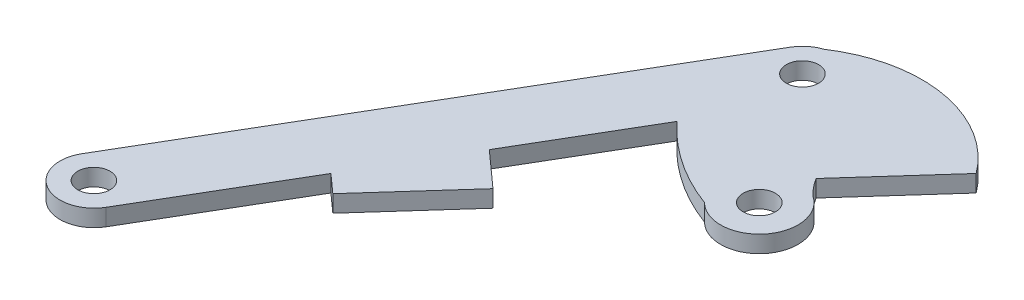
from build123d import *

# Parameters (mm, degrees)
SALIENTE_EXTRUIR1_DEPTH = 15
CROQUIS3_R              = 14.29
CORTAR_EXTRUIR2_DEPTH   = 499.221807184
SALIENTE_EXTRUIR2_DEPTH = 15
SALIENTE_EXTRUIR3_DEPTH = 15
CROQUIS6_R              = 14.29
SALIENTE_EXTRUIR4_DEPTH = 15


with BuildPart() as part:
    # Croquis1 → Saliente-Extruir1 (new body)
    with BuildSketch(Plane(origin=(0, 0, 0), x_dir=(1, 0, 0), z_dir=(0, 1, 0))):
        with BuildLine():
            Line((28.62028588, 380.086840422), (-203.253807163, -15.179678662))
            ThreePointArc((-203.253807163, -15.179678662), (-244.309678662, -25.876192837), (-255.006192837, 15.179678662))
            Line((-255.006192837, 15.179678662), (-23.132099794, 410.446197745))
            ThreePointArc((-23.132099794, 410.446197745), (17.923771705, 421.142711921), (28.62028588, 380.086840422))
        make_face()
    extrude(amount=SALIENTE_EXTRUIR1_DEPTH)

    # Croquis3 → Cortar-Extruir2 (cut, through all)
    with BuildSketch(Plane(origin=(0, 15, 0), x_dir=(1, 0, 0), z_dir=(0, 1, 0))):
        with Locations(Location((-229.13, 0, 0), (0, 0, 270))):
            Circle(CROQUIS3_R)
        with Locations(Location((2.744093043, 395.266519084, 0), (0, 0, 270))):
            Circle(CROQUIS3_R)
    extrude(amount=-CORTAR_EXTRUIR2_DEPTH, mode=Mode.SUBTRACT)

    # Croquis4 → Saliente-Extruir2 (add, through all)
    with BuildSketch(Plane(origin=(0, 15, 0), x_dir=(1, 0, 0), z_dir=(0, 1, 0))):
        Polygon((-113.288910537, 95.628521871), (-129.646022382, 110.296576517), (-77.815690841, 198.649675659), (-46.271672707, 170.362934935), align=None)
    extrude(amount=-SALIENTE_EXTRUIR2_DEPTH)

    # Croquis5 → Saliente-Extruir3 (add, through all)
    with BuildSketch(Plane(origin=(0, 15, 0), x_dir=(1, 0, 0), z_dir=(0, 1, 0))):
        with BuildLine():
            Line((155.952842447, 395.874026356), (88.935604616, 321.139613292))
            ThreePointArc((88.935604616, 321.139613292), (53.823388605, 345.447170601), (11.459302657, 350.833196717))
            Line((11.459302657, 350.833196717), (21.614505852, 387.987304257))
            Line((21.614505852, 387.987304257), (17.093708134, 410.446197745))
            Line((17.093708134, 410.446197745), (-23.132099794, 410.446197745))
            ThreePointArc((-23.132099794, 410.446197745), (-16.015624614, 418.677477916), (-6.431242037, 423.828963415))
            ThreePointArc((-6.431242037, 423.828963415), (80.317160754, 442.127171951), (155.952842447, 395.874026356))
        make_face()
    extrude(amount=-SALIENTE_EXTRUIR3_DEPTH)

    # Croquis6 → Saliente-Extruir4 (add)
    with BuildSketch(Plane(origin=(0, 0, 0), x_dir=(-1, 0, 0), z_dir=(0, -1, 0))):
        with BuildLine():
            Line((16.370108222, 303.393509849), (-7.031750258, 366.185372475))
            Line((-7.031750258, 366.185372475), (-88.935604616, 345.894949454))
            Line((-88.935604616, 345.894949454), (-88.935604616, 321.139613292))
            ThreePointArc((-88.935604616, 321.139613292), (-94.698962335, 313.085487939), (-101.541302009, 305.925347215))
            ThreePointArc((-101.541302009, 305.925347215), (-108.68476793, 255.708040538), (-58.018177093, 253.319826096))
            ThreePointArc((-58.018177093, 253.319826096), (-17.827653511, 273.905315038), (16.370108222, 303.393509849))
        make_face()
        with Locations(Location((-82.26486862, 277.566517623, 0), (0, 0, 90))):
            Circle(CROQUIS6_R, mode=Mode.SUBTRACT)
    extrude(amount=-SALIENTE_EXTRUIR4_DEPTH)


solid = part.part
